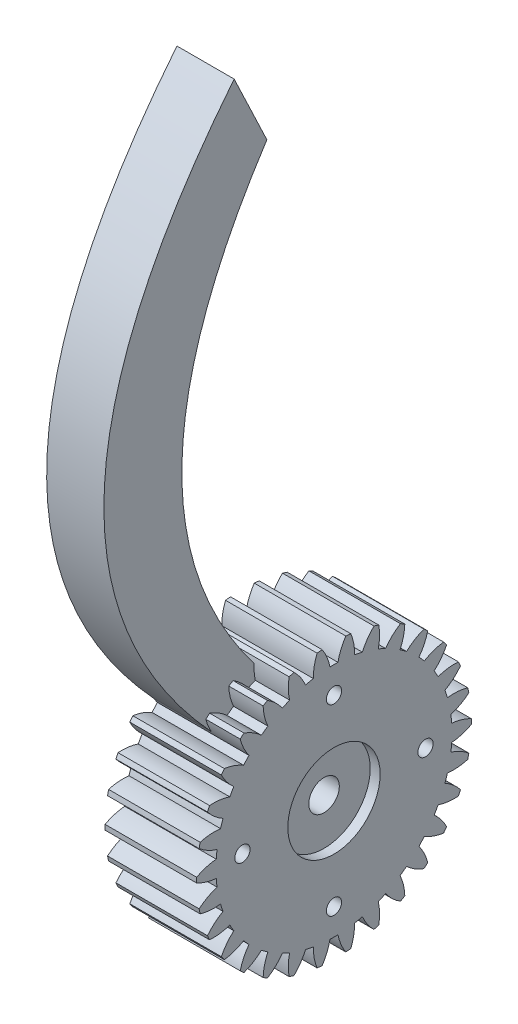
from build123d import *

# Parameters (mm, degrees)
BASPROSKE_W         = 12
BASPROSKE_H         = 18
TOOTHCUT_DEPTH      = 29.142494559
TEETHCUTS_COUNT     = 30
TEETHCUTS_ANGLE     = 348
BORSKE_R            = 2
BORE_DEPTH          = 50.0000508
SKETCH1_R           = 6.05
CUT_EXTRUDE1_DEPTH  = 1.3
SKETCH2_R           = 0.003000182
SKETCH2_R_2         = 1
CUT_EXTRUDE2_DEPTH  = 29.099646783
BOSS_EXTRUDE1_DEPTH = 7.5


with BuildPart() as part:
    # BasProSke → Base-Revolve (revolve)
    with BuildSketch(Plane(origin=(0, 0, 0), x_dir=(1, 0, 0), z_dir=(0, 1, 0)), mode=Mode.PRIVATE) as base_revolve_sk:
        with Locations((6, 9)):
            Rectangle(BASPROSKE_W, BASPROSKE_H)
    revolve(base_revolve_sk.sketch.rotate(Axis((-10, 0, 0), (1, 0, 0)), 180), axis=Axis((-10, 0, 0), (1, 0, 0)))

    # TooCutSke → ToothCut (cut, through all)
    with BuildSketch(Plane(origin=(0, 0, 0), x_dir=(0, 0, -1), z_dir=(1, 0, 0))):
        with BuildLine():
            ThreePointArc((0.523521522, 15.458887906), (0, 15.46775), (-0.523521522, 15.458887906))
            ThreePointArc((-0.523521522, 15.458887906), (-0.919551256, 16.760900189), (-1.568701479, 17.957010353))
            ThreePointArc((-1.568701479, 17.957010353), (0, 18.0254), (1.568701479, 17.957010353))
            ThreePointArc((1.568701479, 17.957010353), (0.919551256, 16.760900189), (0.523521522, 15.458887906))
        make_face()
    toothcut = extrude(amount=TOOTHCUT_DEPTH, mode=Mode.SUBTRACT)

    # TeethCuts: ToothCut ×30 about axis
    teethcuts_axis = Axis((-10, 0, 0), (1, 0, 0))
    for i in range(1, TEETHCUTS_COUNT):
        add(toothcut.rotate(teethcuts_axis, i * TEETHCUTS_ANGLE / (TEETHCUTS_COUNT - 1)), mode=Mode.SUBTRACT)

    # BorSke → Bore (cut, symmetric)
    with BuildSketch(Plane(origin=(0, 0, 0), x_dir=(0, 0, -1), z_dir=(1, 0, 0))):
        with Locations(Location((0, 0, 0), (0, 0, 180))):
            Circle(BORSKE_R)
    extrude(amount=BORE_DEPTH, both=True, mode=Mode.SUBTRACT)

    # Sketch1 → Cut-Extrude1 (cut)
    with BuildSketch(Plane(origin=(12, 0, 0), x_dir=(0, 0, -1), z_dir=(1, 0, 0))):
        Circle(SKETCH1_R)
    extrude(amount=-CUT_EXTRUDE1_DEPTH, mode=Mode.SUBTRACT)

    # Sketch2 → Cut-Extrude2 (cut, through all)
    with BuildSketch(Plane(origin=(12, 0, 0), x_dir=(0, 0, -1), z_dir=(1, 0, 0))):
        with Locations((0, 7.587139872)):
            Circle(SKETCH2_R)
        with Locations((0, 12)):
            Circle(SKETCH2_R_2)
        with Locations((12, 0)):
            Circle(SKETCH2_R_2)
        with Locations((0, -12)):
            Circle(SKETCH2_R_2)
        with Locations((-12, 0)):
            Circle(SKETCH2_R_2)
    extrude(amount=-CUT_EXTRUDE2_DEPTH, mode=Mode.SUBTRACT)

    # Sketch4 → Boss-Extrude1 (add)
    with BuildSketch(Plane.ZY):
        with BuildLine():
            Line((-5, 5), (5, 5))
            add(Edge.make_bspline(
                [(5, 5), (44.428427079, 39.504540856), (8.579816996, 83.962112201)],
                knots=[0, 0, 0, 1, 1, 1], degree=2))
            Line((8.579816996, 83.962112201), (4.291686858, 74.928179507))
            add(Edge.make_bspline(
                [(-5, 5), (30.521033757, 34.885608119), (4.291686858, 74.928179507)],
                knots=[0, 0, 0, 1, 1, 1], degree=2))
        make_face()
    extrude(amount=-BOSS_EXTRUDE1_DEPTH)


solid = part.part
